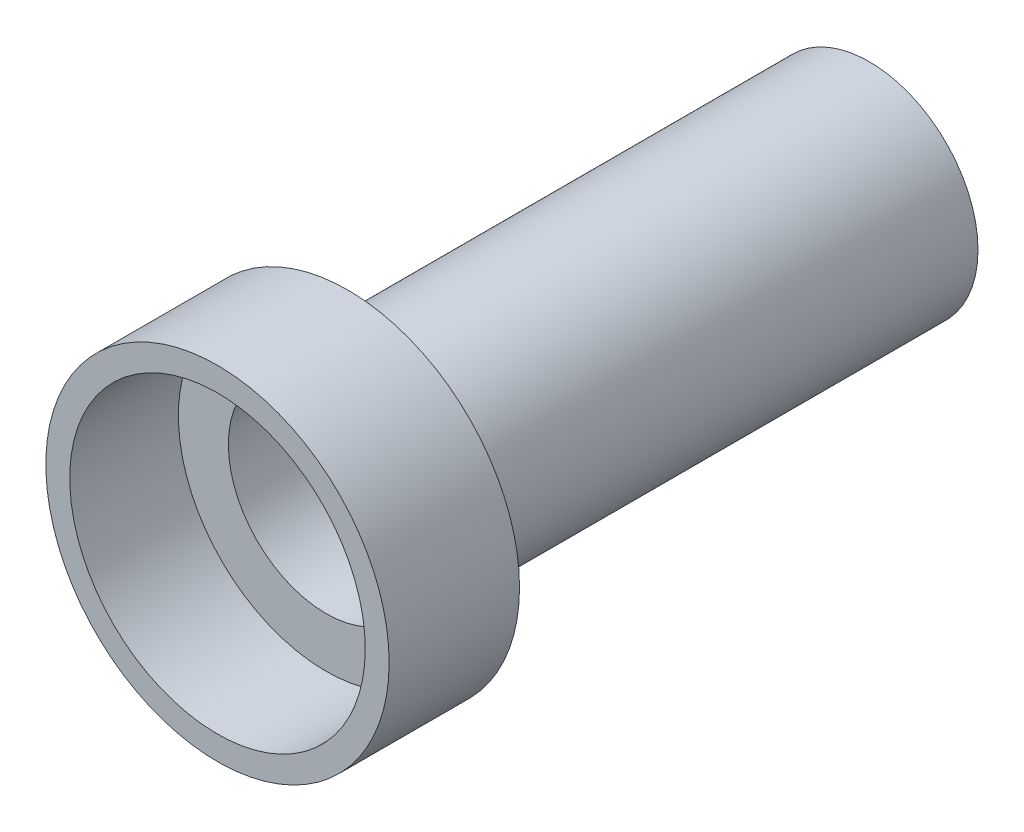
from build123d import *

# Parameters (mm, degrees)
ESQUISSE1_R             = 1.975
BOSS_EXTRU_1_DEPTH      = 1.5
ESQUISSE2_R             = 1.25
BOSS_EXTRU_2_DEPTH      = 6
ESQUISSE3_R             = 1.7
ENL_V_MAT_EXTRU_2_DEPTH = 1.25
ESQUISSE4_R             = 1.125
ENL_V_MAT_EXTRU_4_DEPTH = 51.25


with BuildPart() as part:
    # Esquisse1 → Boss.-Extru.1 (new body)
    with BuildSketch(Plane.XY):
        Circle(ESQUISSE1_R)
    extrude(amount=BOSS_EXTRU_1_DEPTH)

    # Esquisse2 → Boss.-Extru.2 (add)
    with BuildSketch(Plane(origin=(0, 0, 0), x_dir=(-1, 0, 0), z_dir=(0, 0, -1))):
        Circle(ESQUISSE2_R)
    extrude(amount=BOSS_EXTRU_2_DEPTH)

    # Esquisse3 → Enlèv. mat.-Extru.2 (cut)
    with BuildSketch(Plane.XY.offset(1.5)):
        Circle(ESQUISSE3_R)
    extrude(amount=-ENL_V_MAT_EXTRU_2_DEPTH, mode=Mode.SUBTRACT)

    # Esquisse4 → Enlèv. mat.-Extru.4 (cut)
    with BuildSketch(Plane(origin=(0, 0, -6), x_dir=(-1, 0, 0), z_dir=(0, 0, -1))):
        Circle(ESQUISSE4_R)
    extrude(amount=-ENL_V_MAT_EXTRU_4_DEPTH, mode=Mode.SUBTRACT)


solid = part.part
